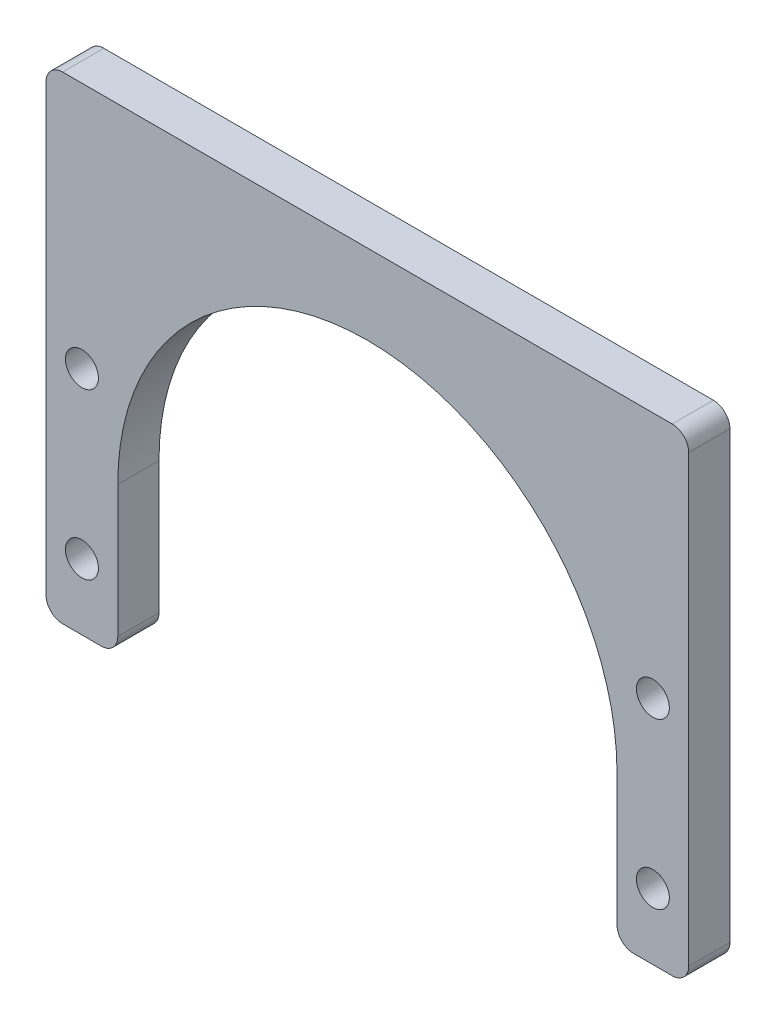
from build123d import *

# Parameters (mm, degrees)
SKETCH_1_R      = 2
SKETCH_1_W      = 8.7
SKETCH_1_H      = 18
EXTRUDE_1_DEPTH = 5
FILLET_1_R      = 2


with BuildPart() as part:
    # 草图1 → 凸台-拉伸1 (new body)
    # profile 1 of 3: a face of its own
    with BuildSketch(Plane.XY):
        with BuildLine():
            Line((39, 40), (-39, 40))
            Line((-39, 40), (-39, 0))
            Line((-39, 0), (-30.3, 0))
            ThreePointArc((-30.3, 0), (0, 30.3), (30.3, 0))
            Line((30.3, 0), (39, 0))
            Line((39, 0), (39, 40))
        make_face()
        with Locations((-34.65, 10)):
            Circle(SKETCH_1_R, mode=Mode.SUBTRACT)
        with Locations((34.65, 10)):
            Circle(SKETCH_1_R, mode=Mode.SUBTRACT)
    # profile 2 of 3: a face of its own
    with BuildSketch(Plane.XY):
        with Locations((-34.65, -9)):
            Rectangle(SKETCH_1_W, SKETCH_1_H)
        with Locations((-34.65, -10)):
            Circle(SKETCH_1_R, mode=Mode.SUBTRACT)
    # profile 3 of 3: a face of its own
    with BuildSketch(Plane.XY):
        with Locations((34.65, -9)):
            Rectangle(SKETCH_1_W, SKETCH_1_H)
        with Locations((34.65, -10)):
            Circle(SKETCH_1_R, mode=Mode.SUBTRACT)
    extrude(amount=EXTRUDE_1_DEPTH)

    # 圆角1
    fillet_1_edges = [part.edges().sort_by_distance(p)[0] for p in [
        (-30.3, -18, 2.5),
        (-39, -18, 2.5),
        (-39, 40, 2.5),
        (39, 40, 2.5),
        (39, -18, 2.5),
        (30.3, -18, 2.5),
    ]]
    fillet(fillet_1_edges, radius=FILLET_1_R)


solid = part.part
